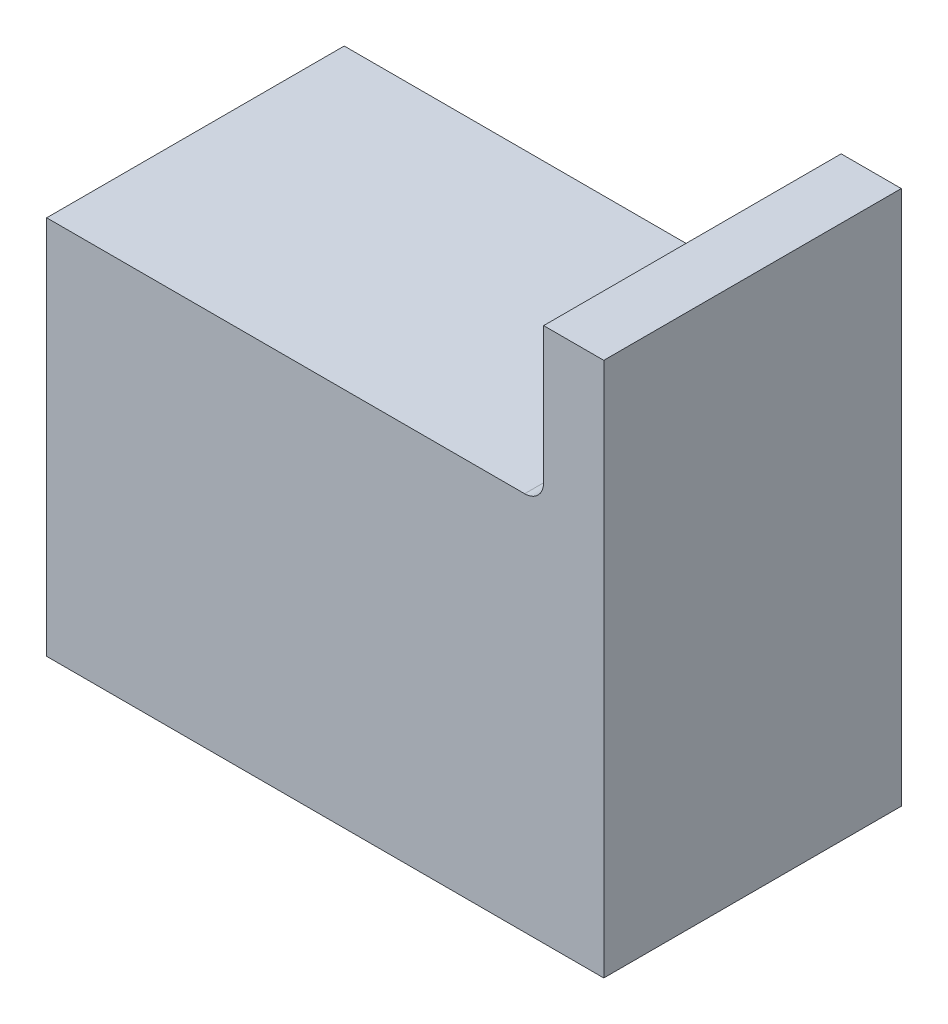
from build123d import *

# Parameters (mm, degrees)
SKETCH1_W           = 88
SKETCH1_H           = 47
SKETCH1_R           = 2.5
BOSS_EXTRUDE1_DEPTH = 60
BOSS_EXTRUDE2_START = 20
SKETCH1_2_R         = 2.5
BOSS_EXTRUDE2_DEPTH = 40
SKETCH2_W           = 9.5
SKETCH2_H           = 47
BOSS_EXTRUDE3_DEPTH = 24.5
FILLET1_R           = 3


with BuildPart() as part:
    # Sketch1 → Boss-Extrude1 (new body)
    with BuildSketch(Plane(origin=(0, 0, 0), x_dir=(1, 0, 0), z_dir=(0, 1, 0))):
        Rectangle(SKETCH1_W, SKETCH1_H)
        with Locations((25.5, 18)):
            Circle(SKETCH1_R, mode=Mode.SUBTRACT)
        with Locations((25.5, -18)):
            Circle(SKETCH1_R, mode=Mode.SUBTRACT)
    extrude(amount=BOSS_EXTRUDE1_DEPTH)

    # Sketch1<2> → Boss-Extrude2 (add)
    with BuildSketch(Plane(origin=(0, 0, 0), x_dir=(1, 0, 0), z_dir=(0, 1, 0)).offset(BOSS_EXTRUDE2_START)):
        with Locations((25.5, 18)):
            Circle(SKETCH1_2_R)
        with Locations((25.5, -18)):
            Circle(SKETCH1_2_R)
    extrude(amount=BOSS_EXTRUDE2_DEPTH)

    # Sketch2 → Boss-Extrude3 (add)
    with BuildSketch(Plane(origin=(0, 60, 0), x_dir=(1, 0, 0), z_dir=(0, 1, 0))):
        with Locations((39.25, 0)):
            Rectangle(SKETCH2_W, SKETCH2_H)
    extrude(amount=BOSS_EXTRUDE3_DEPTH)

    # Fillet1
    fillet1_edges = [part.edges().sort_by_distance(p)[0] for p in [
        (34.5, 60, 0),
    ]]
    fillet(fillet1_edges, radius=FILLET1_R)


solid = part.part
